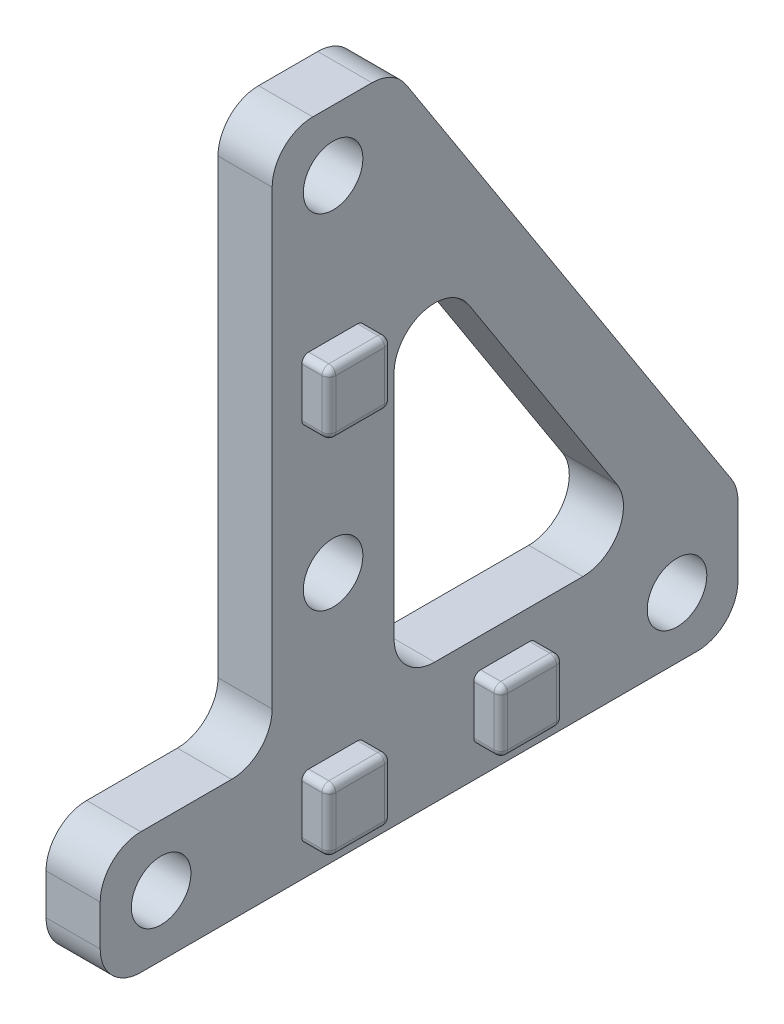
from build123d import *

# Parameters (mm, degrees)
SKETCH1_R           = 2.2
BOSS_EXTRUDE1_DEPTH = 4
FILLET1_R           = 3
SKETCH2_W           = 4.6228
SKETCH2_H           = 4.6228
BOSS_EXTRUDE2_DEPTH = 2
FILLET2_R           = 0.508
FILLET3_R           = 0.508


with BuildPart() as part:
    # Sketch1 → Boss-Extrude1 (new body)
    with BuildSketch(Plane(origin=(0, 0, 0), x_dir=(0, 0, -1), z_dir=(1, 0, 0))):
        Polygon((-4.5, 4.5), (-17.2, 4.5), (-17.2, -4.5), (29.9, -4.5), (29.9, 4.5), (4.5, 43.87), (-4.5, 43.87), align=None)
        with Locations((25.4, 0)):
            Circle(SKETCH1_R, mode=Mode.SUBTRACT)
        with Locations((0, 13.97)):
            Circle(SKETCH1_R, mode=Mode.SUBTRACT)
        with Locations((0, 39.37)):
            Circle(SKETCH1_R, mode=Mode.SUBTRACT)
        with Locations((-12.7, 0)):
            Circle(SKETCH1_R, mode=Mode.SUBTRACT)
        Polygon((4.5, 4.5), (23.949720405, 4.5), (4.5, 34.647066627), align=None, mode=Mode.SUBTRACT)
    extrude(amount=BOSS_EXTRUDE1_DEPTH)

    # Fillet1
    fillet1_edges = [part.edges().sort_by_distance(p)[0] for p in [
        (2, 43.87, 4.5),
        (2, 43.87, -4.5),
        (2, 4.5, -29.9),
        (2, -4.5, -29.9),
        (2, -4.5, 17.2),
        (2, 4.5, 17.2),
        (2, 4.5, 4.5),
        (2, 34.647066627, -4.5),
        (2, 4.5, -4.5),
        (2, 4.5, -23.949720405),
    ]]
    fillet(fillet1_edges, radius=FILLET1_R)

    # Sketch2 → Boss-Extrude2 (add)
    with BuildSketch(Plane(origin=(4, 0, 0), x_dir=(0, 0, -1), z_dir=(1, 0, 0))):
        Rectangle(SKETCH2_W, SKETCH2_H)
        with Locations((12.7, 0)):
            Rectangle(SKETCH2_W, SKETCH2_H)
        with Locations((0, 26.67)):
            Rectangle(SKETCH2_W, SKETCH2_H)
    extrude(amount=BOSS_EXTRUDE2_DEPTH)

    # Fillet2
    fillet2_edges = [part.edges().sort_by_distance(p)[0] for p in [
        (5, 2.3114, 2.3114),
        (5, -2.3114, 2.3114),
        (5, -2.3114, -2.3114),
        (5, 2.3114, -2.3114),
        (5, 2.3114, -10.3886),
        (5, -2.3114, -10.3886),
        (5, -2.3114, -15.0114),
        (5, 2.3114, -15.0114),
        (5, 24.3586, -2.3114),
        (5, 28.9814, -2.3114),
        (5, 28.9814, 2.3114),
        (5, 24.3586, 2.3114),
    ]]
    fillet(fillet2_edges, radius=FILLET2_R)

    # Fillet3
    fillet3_edges = [part.edges().sort_by_distance(p)[0] for p in [
        (6, 2.3114, -12.7),
        (6, 0, -15.0114),
        (6, 0, -10.3886),
        (6, -2.3114, -12.7),
        (6, -2.162610245, -14.862610245),
        (6, -2.162610245, -10.537389755),
        (6, 2.162610245, -10.537389755),
        (6, 2.162610245, -14.862610245),
        (6, 0, -2.3114),
        (6, -2.3114, 0),
        (6, 0, 2.3114),
        (6, 2.3114, 0),
        (6, -2.162610245, 2.162610245),
        (6, 2.162610245, 2.162610245),
        (6, 2.162610245, -2.162610245),
        (6, -2.162610245, -2.162610245),
        (6, 26.67, 2.3114),
        (6, 28.9814, 0),
        (6, 26.67, -2.3114),
        (6, 24.3586, 0),
        (6, 24.507389755, 2.162610245),
        (6, 24.507389755, -2.162610245),
        (6, 28.832610245, -2.162610245),
        (6, 28.832610245, 2.162610245),
    ]]
    fillet(fillet3_edges, radius=FILLET3_R)


solid = part.part
